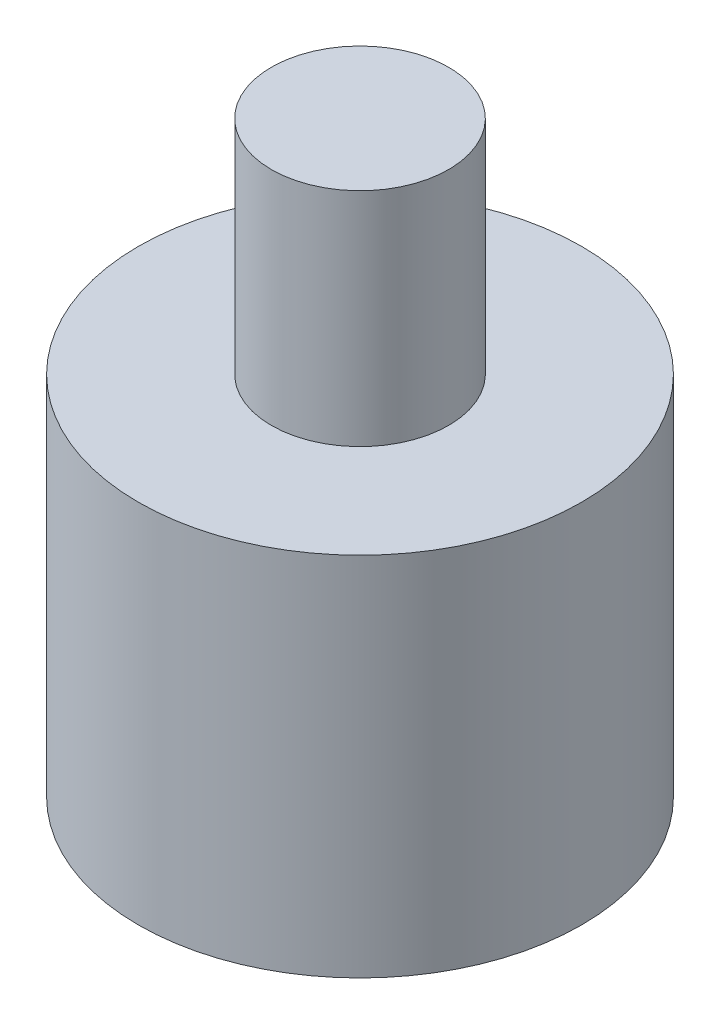
from build123d import *

# Parameters (mm, degrees)
SKETCH_1_R      = 100
EXTRUDE_1_DEPTH = 165.2
SKETCH_3_R      = 40
EXTRUDE_3_DEPTH = 50


with BuildPart() as part:
    # 草图1 → 凸台-拉伸1 (new body)
    with BuildSketch(Plane(origin=(0, 0, 0), x_dir=(1, 0, 0), z_dir=(0, 1, 0))):
        Circle(SKETCH_1_R)
    extrude(amount=EXTRUDE_1_DEPTH)


with BuildPart() as body_2:
    # 草图3 → 凸台-拉伸3 (new, symmetric)
    with BuildSketch(Plane(origin=(0, 215.2, 0), x_dir=(1, 0, 0), z_dir=(0, 1, 0))):
        Circle(SKETCH_3_R)
    extrude(amount=EXTRUDE_3_DEPTH, both=True)


solid = Compound([part.part, body_2.part])
